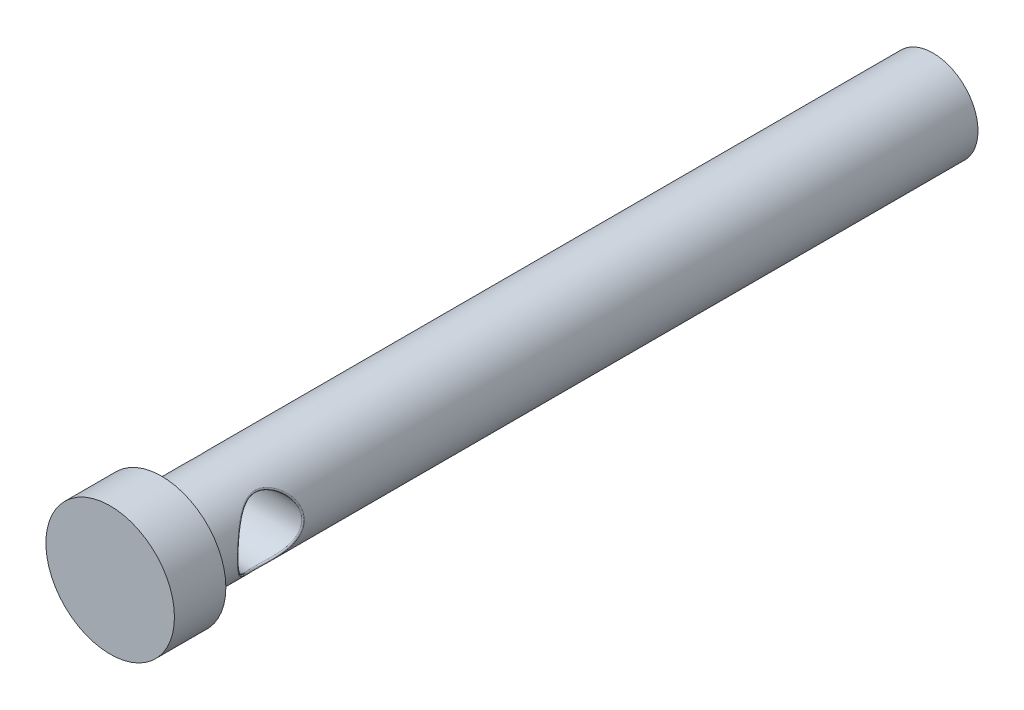
from build123d import *

# Parameters (mm, degrees)
SKETCH1_R           = 3.5
BOSS_EXTRUDE3_DEPTH = 60
SKETCH3_R           = 5
BOSS_EXTRUDE4_DEPTH = 4
SKETCH4_R           = 2.5
CUT_EXTRUDE1_DEPTH  = 141
FILLET3_R           = 0.1
FILLET4_R           = 0.1


with BuildPart() as part:
    # Sketch1 → Boss-Extrude3 (new body)
    with BuildSketch(Plane.XY):
        Circle(SKETCH1_R)
    extrude(amount=BOSS_EXTRUDE3_DEPTH)

    # Sketch3 → Boss-Extrude4 (add)
    with BuildSketch(Plane.XY.offset(60)):
        Circle(SKETCH3_R)
    extrude(amount=BOSS_EXTRUDE4_DEPTH)

    # Sketch4 → Cut-Extrude1 (cut, symmetric)
    with BuildSketch(Plane(origin=(0, 0, 0), x_dir=(0, 0, -1), z_dir=(1, 0, 0))):
        with Locations(Location((-55, 0, 0), (0, 0, 180.000000002))):
            Circle(SKETCH4_R)
    extrude(amount=CUT_EXTRUDE1_DEPTH, both=True, mode=Mode.SUBTRACT)

    # Fillet3
    fillet3_edges = [part.edges().sort_by_distance(p)[0] for p in [
        (2.449489743, 2.5, 55),
    ]]
    fillet(fillet3_edges, radius=FILLET3_R)

    # Fillet4
    fillet4_edges = [part.edges().sort_by_distance(p)[0] for p in [
        (-3.500000008, -1e-09, 52.499999993),
    ]]
    fillet(fillet4_edges, radius=FILLET4_R)


solid = part.part
